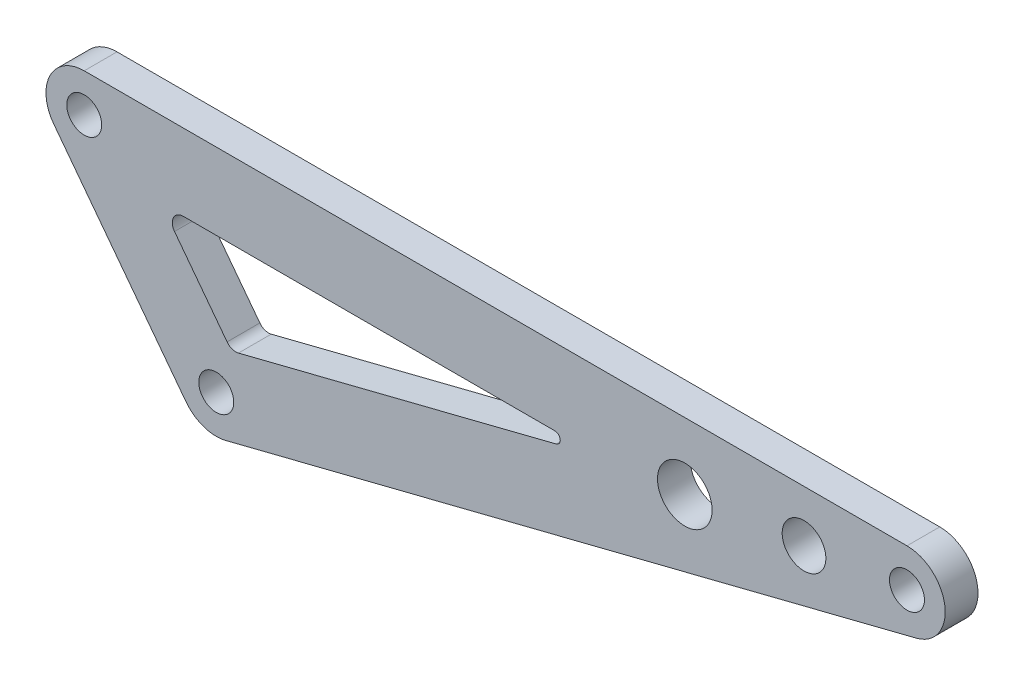
from build123d import *

# Parameters (mm, degrees)
SKETCH_1_R          = 1.6
EXTRUDE_1_DEPTH     = 3
FILLET_1_R          = 0.5
FILLET_2_R          = 1
SKETCH_2_R          = 2.5
SKETCH_2_R_2        = 2
CUT_EXTRUDE_1_DEPTH = 76.782265655


with BuildPart() as part:
    # ｽｹｯﾁ1 → ﾎﾞｽ - 押し出し1 (new body)
    with BuildSketch(Plane.XY):
        with BuildLine():
            Line((-47.808090415, -32.754468565), (27.492971995, -32.754468565))
            ThreePointArc((27.492971995, -32.754468565), (30.96632686, -35.823416389), (28.348513235, -39.64829372))
            Line((28.348513235, -39.64829372), (-34.86772632, -55.584323858))
            ThreePointArc((-34.86772632, -55.584323858), (-36.882286825, -55.493024152), (-38.512072834, -54.305342702))
            Line((-38.512072834, -54.305342702), (-50.596895689, -38.369312564))
            ThreePointArc((-50.596895689, -38.369312564), (-50.942731861, -34.697541141), (-47.808090415, -32.754468565))
        make_face()
        with Locations((-47.808090415, -36.254468565)):
            Circle(SKETCH_1_R, mode=Mode.SUBTRACT)
        with Locations((27.492971995, -36.254468565)):
            Circle(SKETCH_1_R, mode=Mode.SUBTRACT)
        with Locations((-35.72326756, -52.190498703)):
            Circle(SKETCH_1_R, mode=Mode.SUBTRACT)
        Polygon((-40.761361774, -39.754468565), (-0.709511909, -39.754468565), (-34.333570517, -48.230676816), align=None, mode=Mode.SUBTRACT)
    extrude(amount=EXTRUDE_1_DEPTH)

    # ﾌｨﾚｯﾄ1
    fillet_1_edges = [part.edges().sort_by_distance(p)[0] for p in [
        (-0.709511909, -39.754468565, 1.5),
    ]]
    fillet(fillet_1_edges, radius=FILLET_1_R)

    # ﾌｨﾚｯﾄ2
    fillet_2_edges = [part.edges().sort_by_distance(p)[0] for p in [
        (-40.761361774, -39.754468565, 1.5),
        (-34.333570517, -48.230676816, 1.5),
    ]]
    fillet(fillet_2_edges, radius=FILLET_2_R)

    # ｽｹｯﾁ2 → ｶｯﾄ - 押し出し1 (cut, through all)
    with BuildSketch(Plane.XY.offset(3)):
        with Locations((7.159021017, -38.858395913)):
            Circle(SKETCH_2_R)
        with Locations((18.069921542, -37.461166604)):
            Circle(SKETCH_2_R_2)
    extrude(amount=-CUT_EXTRUDE_1_DEPTH, mode=Mode.SUBTRACT)


solid = part.part
